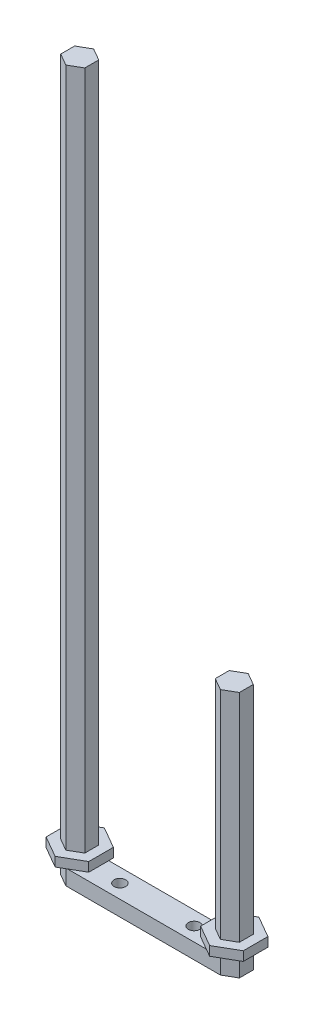
from build123d import *

# Parameters (mm, degrees)
SKETCH1_W           = 50
SKETCH1_H           = 9
SKETCH1_R           = 1.9
BOSS_EXTRUDE1_DEPTH = 5
BOSS_EXTRUDE2_DEPTH = 80
BOSS_EXTRUDE3_DEPTH = 150
BOSS_EXTRUDE4_DEPTH = 3


with BuildPart() as part:
    # Sketch1 → Boss-Extrude1 (new body)
    with BuildSketch(Plane(origin=(0, 0, 0), x_dir=(1, 0, 0), z_dir=(0, 1, 0))):
        with Locations((12, 0)):
            Rectangle(SKETCH1_W, SKETCH1_H)
        with Locations(Location((24, 0, 0), (0, 0, 270))):
            Circle(SKETCH1_R, mode=Mode.SUBTRACT)
        with Locations(Location((0, 0, 0), (0, 0, 270))):
            Circle(SKETCH1_R, mode=Mode.SUBTRACT)
    extrude(amount=BOSS_EXTRUDE1_DEPTH)

    # Sketch3 → Boss-Extrude2 (add)
    with BuildSketch(Plane.XZ):
        Polygon((-13, 4.5), (-16.897114317, 2.25), (-16.897114317, -2.25), (-13, -4.5), (-9.102885683, -2.25), (-9.102885683, 2.25), align=None)
        Polygon((33.102885683, 2.25), (37, 4.5), (40.897114317, 2.25), (40.897114317, -2.25), (37, -4.5), (33.102885683, -2.25), align=None)
    extrude(amount=-BOSS_EXTRUDE2_DEPTH)

    # Sketch4 → Boss-Extrude3 (add)
    with BuildSketch(Plane(origin=(0, 80, 0), x_dir=(1, 0, 0), z_dir=(0, 1, 0))):
        Polygon((-13, -4.5), (-9.102885683, -2.25), (-9.102885683, 2.25), (-13, 4.5), (-16.897114317, 2.25), (-16.897114317, -2.25), align=None)
    extrude(amount=BOSS_EXTRUDE3_DEPTH)

    # Sketch5 → Boss-Extrude4 (add)
    # profile 1 of 2: a face of its own
    with BuildSketch(Plane(origin=(0, 7, 0), x_dir=(-1, 0, 0), z_dir=(0, -1, 0))):
        Polygon((19.897114317, 3.982050808), (19.897114317, -3.982050808), (13, -7.964101615), (6.102885683, -3.982050808), (6.102885683, 3.982050808), (13, 7.964101615), align=None)
        Polygon((16.897114317, -2.25), (13, -4.5), (9.102885683, -2.25), (9.102885683, 2.25), (13, 4.5), (16.897114317, 2.25), align=None, mode=Mode.SUBTRACT)
    # profile 2 of 2: a face of its own
    with BuildSketch(Plane(origin=(0, 7, 0), x_dir=(-1, 0, 0), z_dir=(0, -1, 0))):
        Polygon((-43.897114317, -3.982050808), (-43.897114317, 3.982050808), (-37, 7.964101615), (-30.102885683, 3.982050808), (-30.102885683, -3.982050808), (-37, -7.964101615), align=None)
        Polygon((-33.102885683, 2.25), (-33.102885683, -2.25), (-37, -4.5), (-40.897114317, -2.25), (-40.897114317, 2.25), (-37, 4.5), align=None, mode=Mode.SUBTRACT)
    extrude(amount=-BOSS_EXTRUDE4_DEPTH)


solid = part.part
